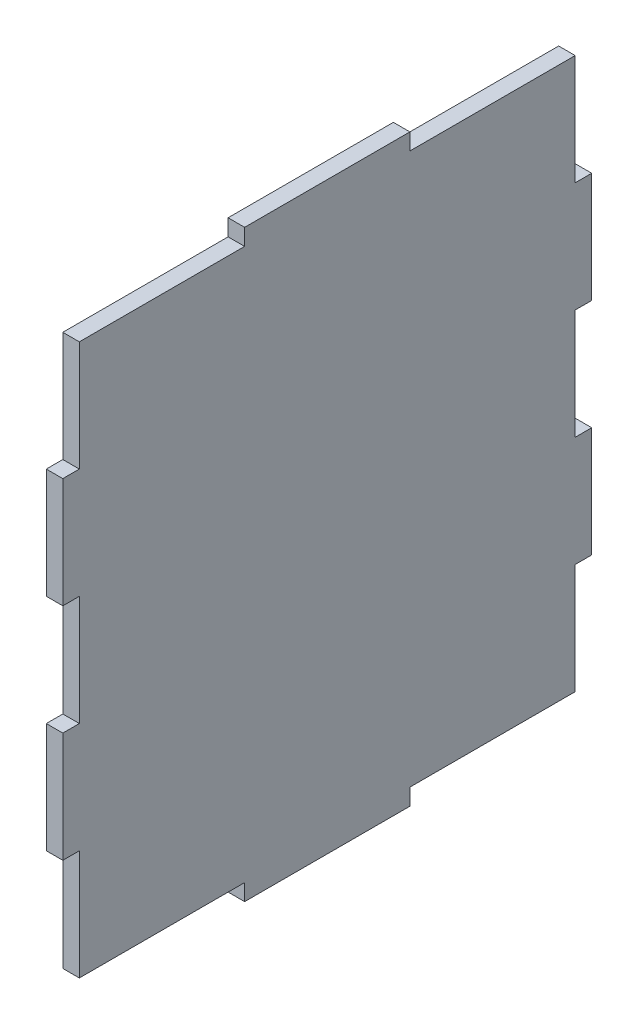
from build123d import *

# Parameters (mm, degrees)
BOSS_EXTRUDE1_DEPTH = 3


with BuildPart() as part:
    # Sketch1 → Boss-Extrude1 (new body)
    with BuildSketch(Plane(origin=(0, 0, 0), x_dir=(0, 0, -1), z_dir=(1, 0, 0))):
        Polygon((33.58490566, 51.603773585), (63.58490566, 51.603773585), (63.58490566, 31.603773585), (66.58490566, 31.603773585), (66.58490566, 11.603773585), (63.58490566, 11.603773585), (63.58490566, -8.396226415), (66.58490566, -8.396226415), (66.58490566, -28.396226415), (63.58490566, -28.396226415), (63.58490566, -48.396226415), (33.58490566, -48.396226415), (33.58490566, -51.396226415), (3.58490566, -51.396226415), (3.58490566, -48.396226415), (-26.41509434, -48.396226415), (-26.41509434, -28.396226415), (-29.41509434, -28.396226415), (-29.41509434, -8.396226415), (-26.41509434, -8.396226415), (-26.41509434, 11.603773585), (-29.41509434, 11.603773585), (-29.41509434, 31.603773585), (-26.41509434, 31.603773585), (-26.41509434, 51.603773585), (3.58490566, 51.603773585), (3.58490566, 54.603773585), (33.58490566, 54.603773585), align=None)
    extrude(amount=BOSS_EXTRUDE1_DEPTH)


solid = part.part
